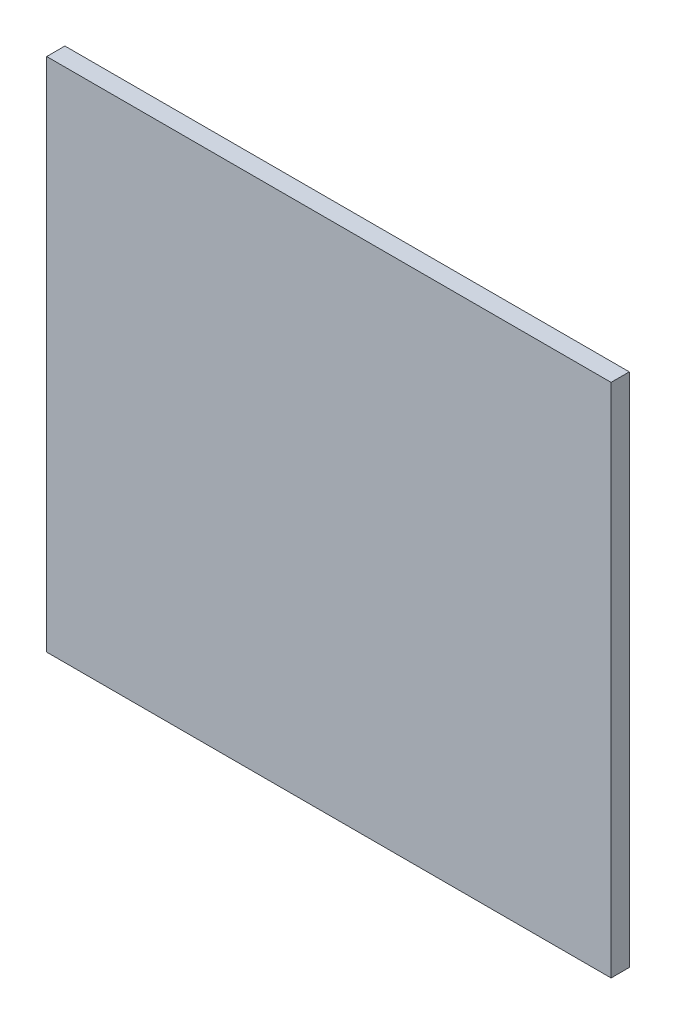
from build123d import *

# Parameters (mm, degrees)
ESQUISSE1_W        = 186
ESQUISSE1_H        = 170
BOSS_EXTRU_1_DEPTH = 6


with BuildPart() as part:
    # Esquisse1 → Boss.-Extru.1 (new body)
    with BuildSketch(Plane.XY):
        with Locations((-93, 85)):
            Rectangle(ESQUISSE1_W, ESQUISSE1_H)
    extrude(amount=BOSS_EXTRU_1_DEPTH)


solid = part.part
